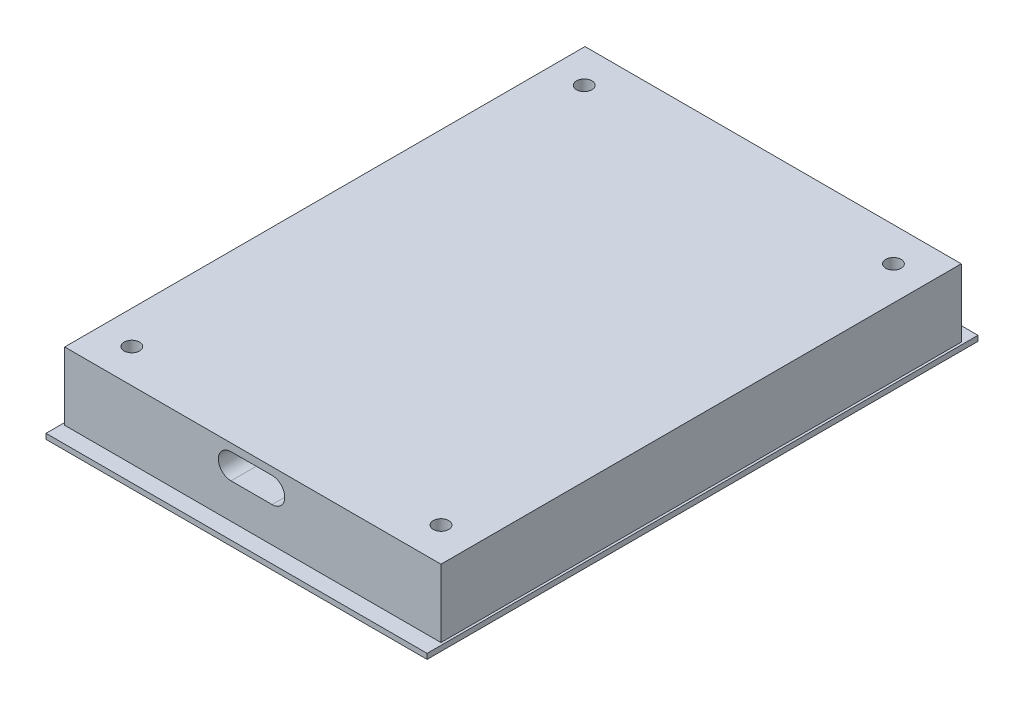
from build123d import *

# Parameters (mm, degrees)
SKETCH_1_W               = 50.54
SKETCH_1_H               = 73.06
EXTRUDE_1_DEPTH          = 0.7
SKETCH_2_W               = 49.9
SKETCH_2_H               = 69
EXTRUDE_2_DEPTH          = 9
CUT_EXTRUDE_1_DEPTH      = 5
HOLE_WIZARD_M2_5_1_D     = 2.05
HOLE_WIZARD_M2_5_1_DEPTH = 4.634117865
HOLE_WIZARD_M2_5_1_TIP   = 0.615882135


with BuildPart() as part:
    # 草图1 → 凸台-拉伸1 (new body)
    with BuildSketch(Plane(origin=(0, 0, 0), x_dir=(1, 0, 0), z_dir=(0, 1, 0))):
        Rectangle(SKETCH_1_W, SKETCH_1_H)
    extrude(amount=EXTRUDE_1_DEPTH)

    # 草图2 → 凸台-拉伸2 (add)
    with BuildSketch(Plane(origin=(0, 0.7, 0), x_dir=(1, 0, 0), z_dir=(0, 1, 0))):
        with Locations((0, 0.13)):
            Rectangle(SKETCH_2_W, SKETCH_2_H)
    extrude(amount=EXTRUDE_2_DEPTH)

    # 草图6 → 切除-拉伸1 (cut)
    with BuildSketch(Plane.XY.offset(34.37)):
        with BuildLine():
            Line((-2.895, 8.7), (2.555, 8.7))
            ThreePointArc((2.555, 8.7), (4.23, 7.025), (2.555, 5.35))
            Line((2.555, 5.35), (-2.895, 5.35))
            ThreePointArc((-2.895, 5.35), (-4.57, 7.025), (-2.895, 8.7))
        make_face()
    extrude(amount=-CUT_EXTRUDE_1_DEPTH, mode=Mode.SUBTRACT)

    # M2.5 螺纹孔1
    with Locations(Plane(origin=(0, 9.7, 0), x_dir=(1, 0, 0), z_dir=(0, 1, 0))):
        with Locations((-20.55, 30.13), (20.45, 30.13), (20.45, -29.87), (-20.55, -29.87)):
            Hole(HOLE_WIZARD_M2_5_1_D / 2, depth=HOLE_WIZARD_M2_5_1_DEPTH)
            with Locations((0, 0, -(HOLE_WIZARD_M2_5_1_DEPTH + HOLE_WIZARD_M2_5_1_TIP / 2))):  # 118° drill point
                Cone(0, HOLE_WIZARD_M2_5_1_D / 2, HOLE_WIZARD_M2_5_1_TIP, mode=Mode.SUBTRACT)


solid = part.part
